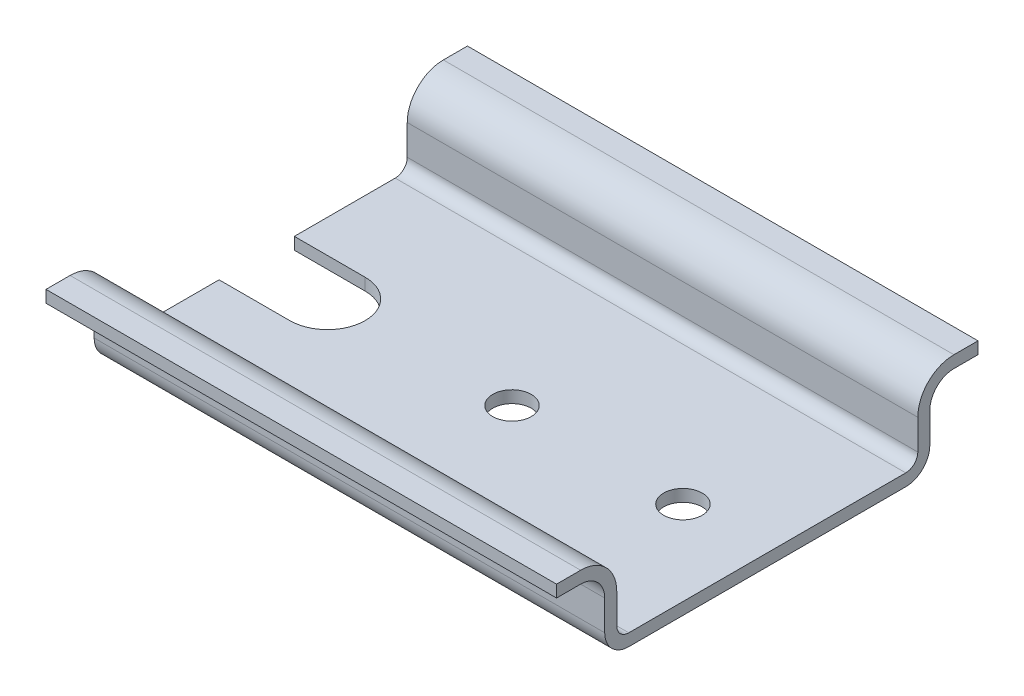
from build123d import *

# Parameters (mm, degrees)
EXTRUDE_THIN1_DEPTH        = 42.4
CUT_EXTRUDE1_REACH         = 48.479
SZKIC1_R                   = 1.6
WYTNIJ_WYCI_GNI_CIE1_DEPTH = 47.478597225


with BuildPart() as part:
    # Sketch1 → Extrude-Thin1 (new body)
    with BuildSketch(Plane(origin=(0, 0, 0), x_dir=(0, 0, -1), z_dir=(1, 0, 0))):
        with BuildLine():
            Line((-17.5, 6.5), (-15.5, 6.5))
            ThreePointArc((-15.5, 6.5), (-14.085786438, 5.914213562), (-13.5, 4.5))
            Line((-13.5, 4.5), (-13.5, 2))
            ThreePointArc((-13.5, 2), (-12.914213562, 0.585786438), (-11.5, 0))
            Line((-11.5, 0), (11.5, 0))
            ThreePointArc((11.5, 0), (12.914213562, 0.585786438), (13.5, 2))
            Line((13.5, 2), (13.5, 4.5))
            ThreePointArc((13.5, 4.5), (14.085786438, 5.914213562), (15.5, 6.5))
            Line((15.5, 6.5), (17.5, 6.5))
            Line((17.5, 6.5), (17.5, 7.5))
            Line((17.5, 7.5), (15.5, 7.5))
            ThreePointArc((15.5, 7.5), (13.378679656, 6.621320344), (12.5, 4.5))
            Line((12.5, 4.5), (12.5, 2))
            ThreePointArc((12.5, 2), (12.207106781, 1.292893219), (11.5, 1))
            Line((11.5, 1), (-11.5, 1))
            ThreePointArc((-11.5, 1), (-12.207106781, 1.292893219), (-12.5, 2))
            Line((-12.5, 2), (-12.5, 4.5))
            ThreePointArc((-12.5, 4.5), (-13.378679656, 6.621320344), (-15.5, 7.5))
            Line((-15.5, 7.5), (-17.5, 7.5))
            Line((-17.5, 7.5), (-17.5, 6.5))
        make_face()
    extrude(amount=EXTRUDE_THIN1_DEPTH)

    # Sketch2 → Cut-Extrude1 (cut, up to next)
    with BuildSketch(Plane.XZ, mode=Mode.PRIVATE) as cut_extrude1_sk1:
        with BuildLine():
            Line((-5.875, 3.125), (5.875, 3.125))
            ThreePointArc((5.875, 3.125), (9, 0), (5.875, -3.125))
            Line((5.875, -3.125), (-5.875, -3.125))
            ThreePointArc((-5.875, -3.125), (-9, 0), (-5.875, 3.125))
        make_face()
    cut_extrude1_tool1 = extrude(cut_extrude1_sk1.sketch, amount=-CUT_EXTRUDE1_REACH, mode=Mode.PRIVATE) & part.part
    add(cut_extrude1_tool1.solids().sort_by_distance((0, 0, 0))[0], mode=Mode.SUBTRACT)

    # Szkic1 → Wytnij-wyciągnięcie1 (cut, through all)
    with BuildSketch(Plane.XZ):
        with Locations(Location((35.396484606, 0, 0), (0, 0, 270))):
            Circle(SZKIC1_R)
        with Locations(Location((21.2, 0, 0), (0, 0, 270))):
            Circle(SZKIC1_R)
    extrude(amount=-WYTNIJ_WYCI_GNI_CIE1_DEPTH, mode=Mode.SUBTRACT)


solid = part.part
